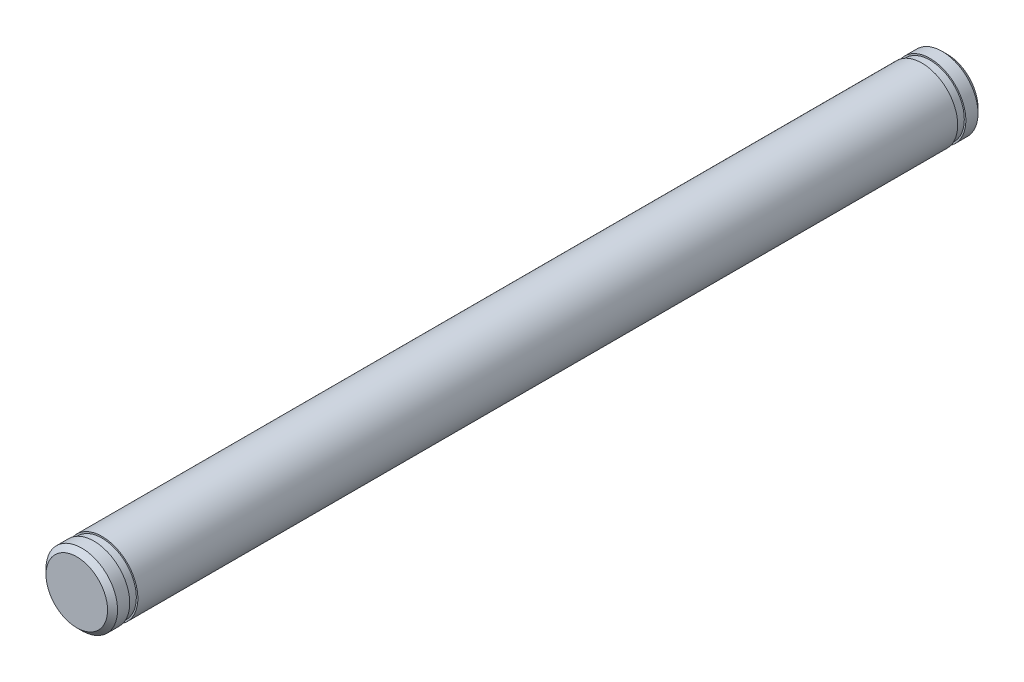
from build123d import *

# Parameters (mm, degrees)
BOSS_EXTRUDE1_DEPTH      = 48.26
BOSS_EXTRUDE1_DEPTH_BACK = 48.26
SKETCH3_R                = 3.96875
CHAMFER1_SIZE            = 0.555625
CUT_EXTRUDE1_START       = -1.905
SKETCH4_R                = 18.115105144
SKETCH4_R_2              = 3.8
CUT_EXTRUDE1_DEPTH       = 0.899999978


with BuildPart() as part:
    # Sketch3 → Boss-Extrude1 (new, two sides: drawn at the far end of the back side and taken through both)
    with BuildSketch(Plane.XY.offset(-BOSS_EXTRUDE1_DEPTH_BACK)):
        with Locations(Location((0, 0, 0), (0, 0, 180))):
            Circle(SKETCH3_R)
    extrude(amount=BOSS_EXTRUDE1_DEPTH + BOSS_EXTRUDE1_DEPTH_BACK)

    # Chamfer1
    chamfer1_edges = [part.edges().sort_by_distance(p)[0] for p in [
        (3.96875, 0, -48.26),
        (3.96875, 0, 48.26),
    ]]
    chamfer(chamfer1_edges, length=CHAMFER1_SIZE)

    # Sketch4 → Cut-Extrude1 (cut)
    with BuildSketch(Plane.XY.offset(48.26).offset(CUT_EXTRUDE1_START)):
        Circle(SKETCH4_R)
        Circle(SKETCH4_R_2, mode=Mode.SUBTRACT)
    cut_extrude1 = extrude(amount=-CUT_EXTRUDE1_DEPTH, mode=Mode.SUBTRACT)

    # Mirror1: Cut-Extrude1 across plane
    add(cut_extrude1.mirror(Plane.XY), mode=Mode.SUBTRACT)


solid = part.part
